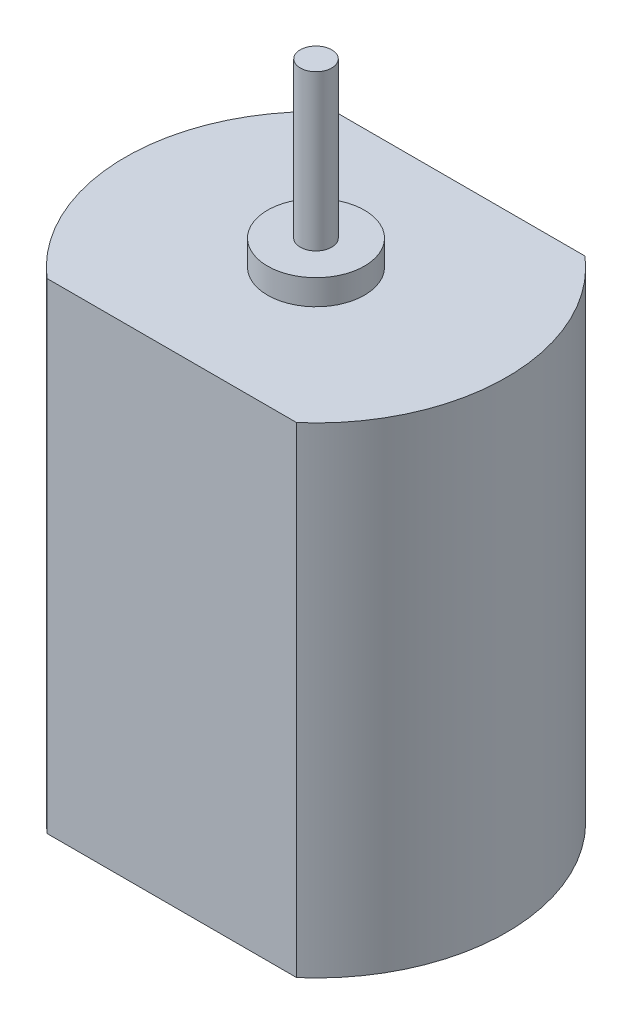
from build123d import *

# Parameters (mm, degrees)
BOSS_EXTRUDE1_DEPTH = 30.5
SKETCH3_R           = 3.075
BOSS_EXTRUDE2_DEPTH = 1.6
SKETCH4_R           = 1
BOSS_EXTRUDE3_DEPTH = 9.85
SKETCH5_R           = 4.25
BOSS_EXTRUDE4_DEPTH = 2


with BuildPart() as part:
    # Sketch2 → Boss-Extrude1 (new body)
    with BuildSketch(Plane(origin=(0, 0, 0), x_dir=(1, 0, 0), z_dir=(0, 1, 0))):
        with BuildLine():
            Line((-7.917543811, 9.15), (7.917543811, 9.15))
            ThreePointArc((7.917543811, 9.15), (12.1, 0), (7.917543811, -9.15))
            Line((7.917543811, -9.15), (-7.917543811, -9.15))
            ThreePointArc((-7.917543811, -9.15), (-12.1, 0), (-7.917543811, 9.15))
        make_face()
    extrude(amount=BOSS_EXTRUDE1_DEPTH)

    # Sketch3 → Boss-Extrude2 (add)
    with BuildSketch(Plane(origin=(0, 30.5, 0), x_dir=(1, 0, 0), z_dir=(0, 1, 0))):
        with Locations(Location((0, 0, 0), (0, 0, 270))):
            Circle(SKETCH3_R)
    extrude(amount=BOSS_EXTRUDE2_DEPTH)

    # Sketch4 → Boss-Extrude3 (add)
    with BuildSketch(Plane(origin=(0, 32.1, 0), x_dir=(1, 0, 0), z_dir=(0, 1, 0))):
        with Locations(Location((0, 0, 0), (0, 0, 270))):
            Circle(SKETCH4_R)
    extrude(amount=BOSS_EXTRUDE3_DEPTH)

    # Sketch5 → Boss-Extrude4 (add)
    with BuildSketch(Plane.XZ):
        with Locations(Location((0, 0, 0), (0, 0, 270))):
            Circle(SKETCH5_R)
    extrude(amount=BOSS_EXTRUDE4_DEPTH)


solid = part.part
